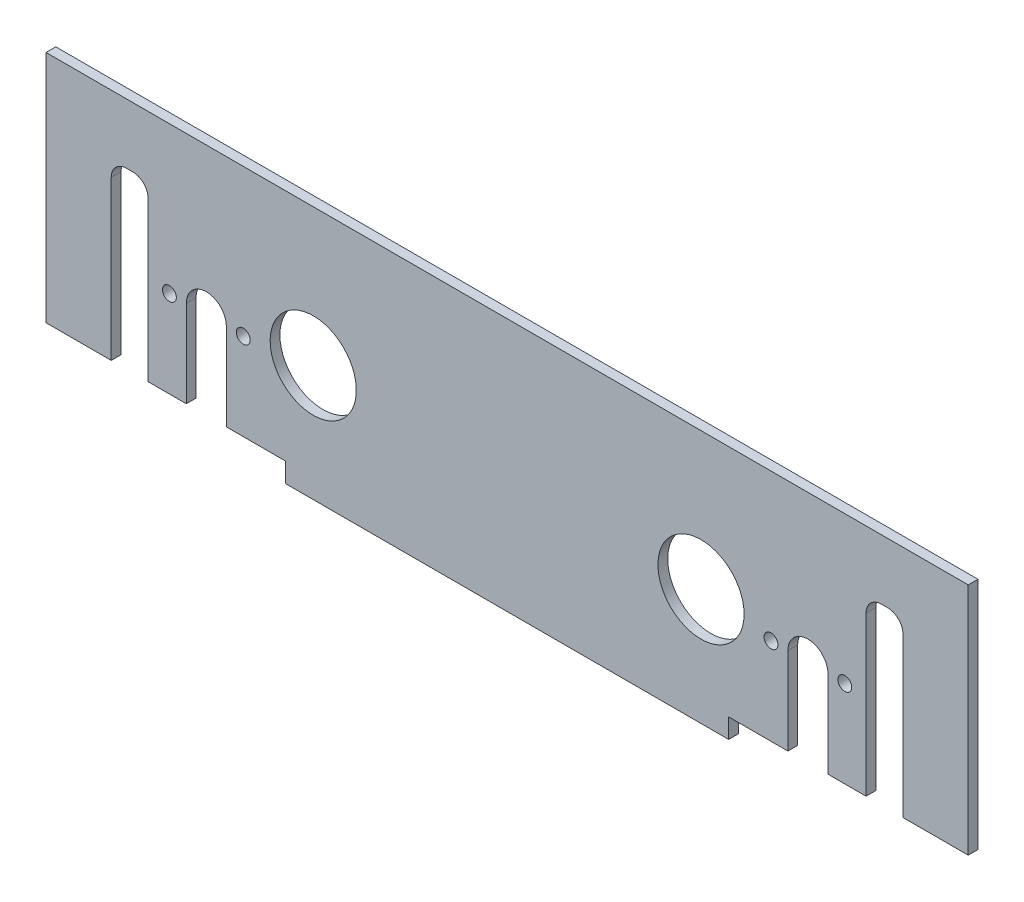
from build123d import *

# Parameters (mm, degrees)
SKETCH1_W            = 299.7
SKETCH1_H            = 76.075
BOSS_EXTRUDE1_DEPTH  = 3.175
CUT_EXTRUDE4_DEPTH   = 155.634907221
SKETCH3_R            = 6.5
CUT_EXTRUDE5_DEPTH   = 155.634907221
M4_CLEARANCE_HOLE1_D = 4.5
SKETCH12_W           = 144
SKETCH12_H           = 3.175
BOSS_EXTRUDE2_DEPTH  = 6.35
SKETCH13_R           = 14
CUT_EXTRUDE6_DEPTH   = 157.318115653


with BuildPart() as part:
    # Sketch1 → Boss-Extrude1 (new body)
    with BuildSketch(Plane.XY):
        Rectangle(SKETCH1_W, SKETCH1_H)
    extrude(amount=BOSS_EXTRUDE1_DEPTH)

    # Sketch8 → Cut-Extrude4 (cut, through all)
    with BuildSketch(Plane.XY.offset(3.175)):
        with BuildLine():
            Line((121.65, 18.5125), (123.65, 18.5125))
            ThreePointArc((123.65, 18.5125), (127.185533906, 17.048033906), (128.65, 13.5125))
            Line((128.65, 13.5125), (128.65, -27.282435401))
            ThreePointArc((128.65, -27.282435401), (127.185533906, -30.817969307), (123.65, -32.282435401))
            Line((123.65, -32.282435401), (121.65, -32.282435401))
            ThreePointArc((121.65, -32.282435401), (118.114466094, -30.817969307), (116.65, -27.282435401))
            Line((116.65, -27.282435401), (116.65, 13.5125))
            ThreePointArc((116.65, 13.5125), (118.114466094, 17.048033906), (121.65, 18.5125))
        make_face()
        with BuildLine():
            Line((128.65, -38.0375), (128.65, -27.282435401))
            ThreePointArc((128.65, -27.282435401), (127.185533906, -30.817969307), (123.65, -32.282435401))
            Line((123.65, -32.282435401), (121.65, -32.282435401))
            ThreePointArc((121.65, -32.282435401), (118.114466094, -30.817969307), (116.65, -27.282435401))
            Line((116.65, -27.282435401), (116.65, -38.0375))
            Line((116.65, -38.0375), (128.65, -38.0375))
        make_face()
    cut_extrude4 = extrude(amount=-CUT_EXTRUDE4_DEPTH, mode=Mode.SUBTRACT)

    # Mirror3: Cut-Extrude4 across plane
    add(cut_extrude4.mirror(Plane(origin=(0, 0, 0), x_dir=(0, 0, 1), z_dir=(1, 0, 0))), mode=Mode.SUBTRACT)

    # Sketch3 → Cut-Extrude5 (cut, through all)
    with BuildSketch(Plane(origin=(0, 0, 0), x_dir=(-1, 0, 0), z_dir=(0, 0, -1))):
        with Locations((-97.75, -9.7625)):
            Circle(SKETCH3_R)
        with BuildLine():
            Line((-104.25, -38.0375), (-91.25, -38.0375))
            Line((-91.25, -38.0375), (-91.25, -9.7625))
            ThreePointArc((-91.25, -9.7625), (-97.75, -16.2625), (-104.25, -9.7625))
            Line((-104.25, -9.7625), (-104.25, -38.0375))
        make_face()
        with Locations((97.75, -9.7625)):
            Circle(SKETCH3_R)
        with BuildLine():
            Line((91.25, -38.0375), (104.25, -38.0375))
            Line((104.25, -38.0375), (104.25, -9.7625))
            ThreePointArc((104.25, -9.7625), (97.75, -16.2625), (91.25, -9.7625))
            Line((91.25, -9.7625), (91.25, -38.0375))
        make_face()
    extrude(amount=-CUT_EXTRUDE5_DEPTH, mode=Mode.SUBTRACT)

    # M4 Clearance Hole1 (through all)
    with Locations(Plane(origin=(0, 0, 0), x_dir=(-1, 0, 0), z_dir=(0, 0, -1))):
        with Locations((-85.75, -9.7625), (-109.75, -9.7625), (109.75, -9.7625), (85.75, -9.7625)):
            Hole(M4_CLEARANCE_HOLE1_D / 2)

    # Sketch12 → Boss-Extrude2 (add)
    with BuildSketch(Plane.XZ.offset(38.0375)):
        with Locations((0, 1.5875)):
            Rectangle(SKETCH12_W, SKETCH12_H)
    extrude(amount=BOSS_EXTRUDE2_DEPTH)

    # Sketch13 → Cut-Extrude6 (cut, through all)
    with BuildSketch(Plane(origin=(0, 0, 0), x_dir=(-1, 0, 0), z_dir=(0, 0, -1))):
        with Locations((63.008899223, -6.644651545)):
            Circle(SKETCH13_R)
    cut_extrude6 = extrude(amount=-CUT_EXTRUDE6_DEPTH, mode=Mode.SUBTRACT)

    # Mirror4: Cut-Extrude6 across plane
    add(cut_extrude6.mirror(Plane(origin=(0, 0, 0), x_dir=(0, 0, 1), z_dir=(1, 0, 0))), mode=Mode.SUBTRACT)


solid = part.part
